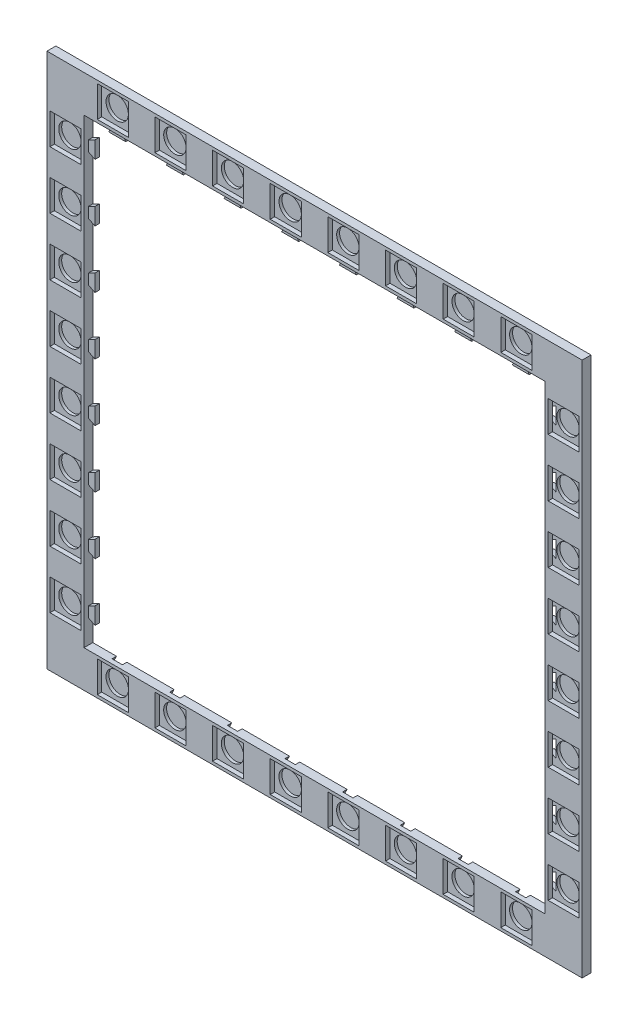
from build123d import *

# Parameters (mm, degrees)
SKETCH1_W           = 362
SKETCH1_H           = 362.000008094
BOSS_EXTRUDE1_DEPTH = 3
CUT_EXTRUDE3_DEPTH  = 3
SKETCH3_W           = 362.000008094
SKETCH3_H           = 362
BOSS_EXTRUDE3_DEPTH = 3
SKETCH4_W           = 21
SKETCH4_H           = 21
CUT_EXTRUDE4_DEPTH  = 3
SKETCH5_W           = 21
SKETCH5_H           = 21
CUT_EXTRUDE5_DEPTH  = 3
SKETCH6_R           = 7.56
SKETCH6_R_2         = 7.6
CUT_EXTRUDE6_DEPTH  = 2


with BuildPart() as part:
    # Sketch1 → Boss-Extrude1 (new body)
    with BuildSketch(Plane(origin=(0, 0, 0), x_dir=(0, 1, 0), z_dir=(0, 0, 1))):
        with Locations((-5.680321329, -10.540141208)):
            Rectangle(SKETCH1_W, SKETCH1_H)
    extrude(amount=BOSS_EXTRUDE1_DEPTH)

    # Sketch2 → Cut-Extrude3 (cut)
    with BuildSketch(Plane(origin=(0, 0, 0), x_dir=(1, 0, 0), z_dir=(0, 0, -1))):
        Polygon((166.540137161, -150.319686765), (166.540137161, -134.319686765), (171.010908345, -136.558482204), (171.010908345, -125.080891326), (166.540137161, -127.319686765), (166.540137161, -95.319686765), (171.010908345, -97.558482204), (171.010908345, -86.080891326), (166.540137161, -88.319686765), (166.540137161, -56.319686765), (171.010908345, -58.558482204), (171.010908345, -47.080891326), (166.540137161, -49.319686765), (166.540137161, -17.319686765), (171.010908345, -19.558482204), (171.010908345, -8.080891326), (166.540137161, -10.319686765), (166.540137161, 21.680313235), (171.010908345, 19.441517796), (171.010908345, 30.919108674), (166.540137161, 28.680313235), (166.540137161, 60.680313235), (171.010908345, 58.441517796), (171.010908345, 69.919108674), (166.540137161, 67.680313235), (166.540137161, 99.680313235), (171.010908345, 97.441517796), (171.010908345, 108.919108674), (166.540137161, 106.680313235), (166.540137161, 138.680313235), (171.010908345, 136.441517796), (171.010908345, 147.919108674), (166.540137161, 145.680313235), (166.540137161, 161.680313235), (150.540137161, 161.68031365), (152.778932716, 166.151084776), (141.301341838, 166.151085074), (143.540137161, 161.680313832), (111.540137161, 161.680314662), (113.778932716, 166.151085788), (102.301341838, 166.151086086), (104.540137161, 161.680314843), (72.540137161, 161.680315674), (74.778932716, 166.1510868), (63.301341838, 166.151087097), (65.540137161, 161.680315855), (33.540137161, 161.680316685), (35.778932716, 166.151087811), (24.301341838, 166.151088109), (26.540137161, 161.680316867), (-5.459862839, 161.680317697), (-3.221067284, 166.151088823), (-14.698658162, 166.151089121), (-12.459862839, 161.680317879), (-44.459862839, 161.680318709), (-42.221067284, 166.151089835), (-53.698658162, 166.151090133), (-51.459862839, 161.68031889), (-83.459862839, 161.680319721), (-81.221067284, 166.151090847), (-92.698658162, 166.151091144), (-90.459862839, 161.680319902), (-122.459862839, 161.680320732), (-120.221067284, 166.151091858), (-131.698658162, 166.151092156), (-129.459862839, 161.680320914), (-145.459862839, 161.680321329), (-145.459862839, 145.680321329), (-140.989091655, 147.919116768), (-140.989091655, 136.44152589), (-145.459862839, 138.680321329), (-145.459862839, 106.680321329), (-140.989091655, 108.919116768), (-140.989091655, 97.44152589), (-145.459862839, 99.680321329), (-145.459862839, 67.680321329), (-140.989091655, 69.919116768), (-140.989091655, 58.44152589), (-145.459862839, 60.680321329), (-145.459862839, 28.680321329), (-140.989091655, 30.919116768), (-140.989091655, 19.44152589), (-145.459862839, 21.680321329), (-145.459862839, -10.319678671), (-140.989091655, -8.080883232), (-140.989091655, -19.55847411), (-145.459862839, -17.319678671), (-145.459862839, -49.319678671), (-140.989091655, -47.080883232), (-140.989091655, -58.55847411), (-145.459862839, -56.319678671), (-145.459862839, -88.319678671), (-140.989091655, -86.080883232), (-140.989091655, -97.55847411), (-145.459862839, -95.319678671), (-145.459862839, -127.319678671), (-140.989091655, -125.080883232), (-140.989091655, -136.55847411), (-145.459862839, -134.319678671), (-145.459862839, -150.319678671), (-129.459862839, -150.319678671), (-131.698658278, -145.848907487), (-120.2210674, -145.848907487), (-122.459862839, -150.319678671), (-90.459862839, -150.319678671), (-92.698658278, -145.848907487), (-81.2210674, -145.848907487), (-83.459862839, -150.319678671), (-51.459862839, -150.319678671), (-53.698658278, -145.848907487), (-42.2210674, -145.848907487), (-44.459862839, -150.319678671), (-12.459862839, -150.319678671), (-14.698658278, -145.848907487), (-3.2210674, -145.848907487), (-5.459862839, -150.319678671), (26.540137161, -150.319678671), (24.301341722, -145.848907487), (35.7789326, -145.848907487), (33.540137161, -150.319678671), (65.540137161, -150.319678671), (63.301341722, -145.848907487), (74.7789326, -145.848907487), (72.540137161, -150.319678671), (104.540137161, -150.319678671), (102.301341722, -145.848907487), (113.7789326, -145.848907487), (111.540137161, -150.319678671), (143.540137161, -150.319678671), (141.301341722, -145.848907487), (152.7789326, -145.848907487), (150.540137161, -150.319678671), align=None)
    extrude(amount=-CUT_EXTRUDE3_DEPTH, mode=Mode.SUBTRACT)

    # Sketch3 → Boss-Extrude3 (add)
    with BuildSketch(Plane.XY.offset(3)):
        with Locations((10.540141208, -5.680321329)):
            Rectangle(SKETCH3_W, SKETCH3_H)
        Polygon((-145.459862839, 150.319678671), (166.540137161, 150.319686765), (166.540137161, -161.680313235), (-145.459862839, -161.680321329), align=None, mode=Mode.SUBTRACT)
    extrude(amount=BOSS_EXTRUDE3_DEPTH)

    # Sketch4 → Cut-Extrude4 (cut)
    with BuildSketch(Plane.XY.offset(6)):
        with Locations((-157.959862839, -142.180321329)):
            Rectangle(SKETCH4_W, SKETCH4_H)
        with Locations((-157.959862839, -103.180321329)):
            Rectangle(SKETCH4_W, SKETCH4_H)
        with Locations((-157.959862839, -64.180321329)):
            Rectangle(SKETCH4_W, SKETCH4_H)
        with Locations((-157.959862839, -25.180321329)):
            Rectangle(SKETCH4_W, SKETCH4_H)
        with Locations((-157.959862839, 13.819678671)):
            Rectangle(SKETCH4_W, SKETCH4_H)
        with Locations((-157.959862839, 52.819678671)):
            Rectangle(SKETCH4_W, SKETCH4_H)
        with Locations((-157.959862839, 91.819678671)):
            Rectangle(SKETCH4_W, SKETCH4_H)
        with Locations((-157.959862839, 130.819678671)):
            Rectangle(SKETCH4_W, SKETCH4_H)
        with Locations((179.040145255, -142.180321329)):
            Rectangle(SKETCH4_W, SKETCH4_H)
        with Locations((179.040145255, -64.180321329)):
            Rectangle(SKETCH4_W, SKETCH4_H)
        with Locations((179.040145255, 52.819678671)):
            Rectangle(SKETCH4_W, SKETCH4_H)
        with Locations((179.040145255, -25.180321329)):
            Rectangle(SKETCH4_W, SKETCH4_H)
        with Locations((179.040145255, 13.819678671)):
            Rectangle(SKETCH4_W, SKETCH4_H)
        with Locations((179.040145255, -103.180321329)):
            Rectangle(SKETCH4_W, SKETCH4_H)
        with Locations((179.040145255, 91.819678671)):
            Rectangle(SKETCH4_W, SKETCH4_H)
        with Locations((179.040145255, 130.819678671)):
            Rectangle(SKETCH4_W, SKETCH4_H)
    extrude(amount=-CUT_EXTRUDE4_DEPTH, mode=Mode.SUBTRACT)

    # Sketch5 → Cut-Extrude5 (cut)
    with BuildSketch(Plane.XY.offset(6)):
        with Locations((-125.959862839, 162.819678671)):
            Rectangle(SKETCH5_W, SKETCH5_H)
        with Locations((-86.959862839, 162.819678671)):
            Rectangle(SKETCH5_W, SKETCH5_H)
        with Locations((-47.959862839, 162.819678671)):
            Rectangle(SKETCH5_W, SKETCH5_H)
        with Locations((-8.959862839, 162.819678671)):
            Rectangle(SKETCH5_W, SKETCH5_H)
        with Locations((30.040137161, 162.819678671)):
            Rectangle(SKETCH5_W, SKETCH5_H)
        with Locations((69.040137161, 162.819678671)):
            Rectangle(SKETCH5_W, SKETCH5_H)
        with Locations((108.040137161, 162.819678671)):
            Rectangle(SKETCH5_W, SKETCH5_H)
        with Locations((147.040137161, 162.819678671)):
            Rectangle(SKETCH5_W, SKETCH5_H)
        with Locations((69.040137161, -174.180321329)):
            Rectangle(SKETCH5_W, SKETCH5_H)
        with Locations((147.040137161, -174.180321329)):
            Rectangle(SKETCH5_W, SKETCH5_H)
        with Locations((-86.959862839, -174.180321329)):
            Rectangle(SKETCH5_W, SKETCH5_H)
        with Locations((-125.959862839, -174.180321329)):
            Rectangle(SKETCH5_W, SKETCH5_H)
        with Locations((-8.959862839, -174.180321329)):
            Rectangle(SKETCH5_W, SKETCH5_H)
        with Locations((108.040137161, -174.180321329)):
            Rectangle(SKETCH5_W, SKETCH5_H)
        with Locations((30.040137161, -174.180321329)):
            Rectangle(SKETCH5_W, SKETCH5_H)
        with Locations((-47.959862839, -174.180321329)):
            Rectangle(SKETCH5_W, SKETCH5_H)
    extrude(amount=-CUT_EXTRUDE5_DEPTH, mode=Mode.SUBTRACT)

    # Sketch6 → Cut-Extrude6 (cut)
    with BuildSketch(Plane.XY.offset(3)):
        with Locations((-157.959862839, 130.819678671)):
            Circle(SKETCH6_R)
        with Locations((-125.959862839, -174.180321329)):
            Circle(SKETCH6_R_2)
        with Locations((179.040145255, 130.819678671)):
            Circle(SKETCH6_R_2)
        with Locations((-125.959862839, 162.819678671)):
            Circle(SKETCH6_R)
        with Locations((-86.959862839, 162.819678671)):
            Circle(SKETCH6_R)
        with Locations((-47.959862839, 162.819678671)):
            Circle(SKETCH6_R)
        with Locations((-8.959862839, 162.819678671)):
            Circle(SKETCH6_R)
        with Locations((30.040137161, 162.819678671)):
            Circle(SKETCH6_R)
        with Locations((69.040137161, 162.819678671)):
            Circle(SKETCH6_R)
        with Locations((108.040137161, 162.819678671)):
            Circle(SKETCH6_R)
        with Locations((147.040137161, 162.819678671)):
            Circle(SKETCH6_R)
        with Locations((-157.959862839, 91.819678671)):
            Circle(SKETCH6_R)
        with Locations((-157.959862839, 52.819678671)):
            Circle(SKETCH6_R)
        with Locations((-157.959862839, 13.819678671)):
            Circle(SKETCH6_R)
        with Locations((-157.959862839, -25.180321329)):
            Circle(SKETCH6_R)
        with Locations((-157.959862839, -64.180321329)):
            Circle(SKETCH6_R)
        with Locations((-157.959862839, -103.180321329)):
            Circle(SKETCH6_R)
        with Locations((-157.959862839, -142.180321329)):
            Circle(SKETCH6_R)
        with Locations((-86.959862839, -174.180321329)):
            Circle(SKETCH6_R_2)
        with Locations((-47.959862839, -174.180321329)):
            Circle(SKETCH6_R_2)
        with Locations((-8.959862839, -174.180321329)):
            Circle(SKETCH6_R_2)
        with Locations((30.040137161, -174.180321329)):
            Circle(SKETCH6_R_2)
        with Locations((69.040137161, -174.180321329)):
            Circle(SKETCH6_R_2)
        with Locations((108.040137161, -174.180321329)):
            Circle(SKETCH6_R_2)
        with Locations((147.040137161, -174.180321329)):
            Circle(SKETCH6_R_2)
        with Locations((179.040145255, 91.819678671)):
            Circle(SKETCH6_R_2)
        with Locations((179.040145255, 52.819678671)):
            Circle(SKETCH6_R_2)
        with Locations((179.040145255, 13.819678671)):
            Circle(SKETCH6_R_2)
        with Locations((179.040145255, -25.180321329)):
            Circle(SKETCH6_R_2)
        with Locations((179.040145255, -64.180321329)):
            Circle(SKETCH6_R_2)
        with Locations((179.040145255, -103.180321329)):
            Circle(SKETCH6_R_2)
        with Locations((179.040145255, -142.180321329)):
            Circle(SKETCH6_R_2)
    extrude(amount=-CUT_EXTRUDE6_DEPTH, mode=Mode.SUBTRACT)


solid = part.part
